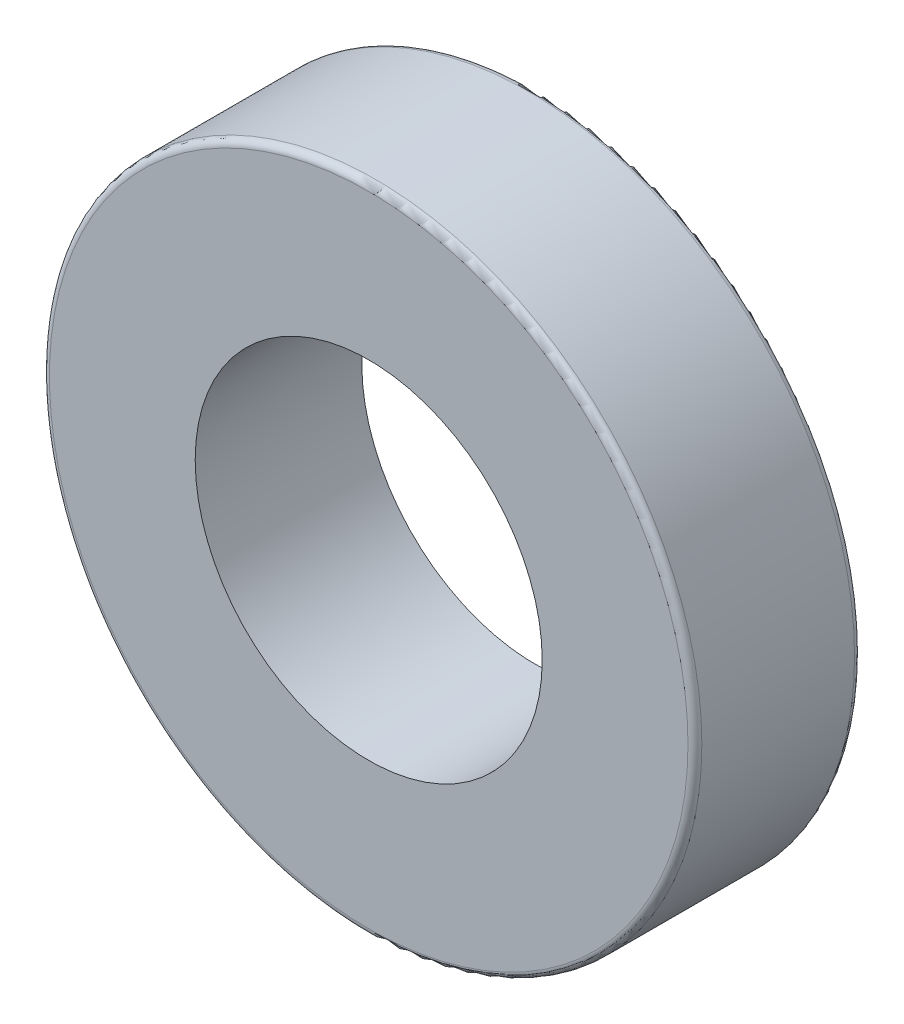
from build123d import *

# Parameters (mm, degrees)
SKETCH2_R           = 23.5
SKETCH2_R_2         = 12.5
BOSS_EXTRUDE1_DEPTH = 12
FILLET1_R           = 0.5


with BuildPart() as part:
    # Sketch2 → Boss-Extrude1 (new body)
    with BuildSketch(Plane.XY):
        Circle(SKETCH2_R)
        Circle(SKETCH2_R_2, mode=Mode.SUBTRACT)
    extrude(amount=BOSS_EXTRUDE1_DEPTH)

    # Fillet1
    fillet1_edges = [part.edges().sort_by_distance(p)[0] for p in [
        (-23.5, 0, 0),
        (-23.5, 0, 12),
    ]]
    fillet(fillet1_edges, radius=FILLET1_R)


solid = part.part
